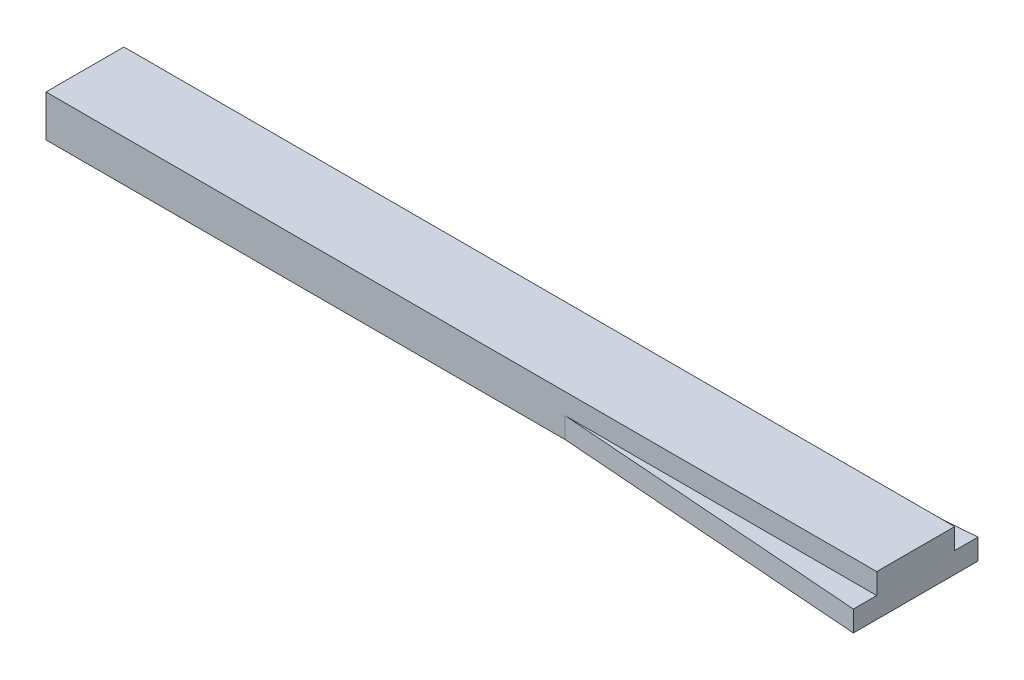
from build123d import *

# Parameters (mm, degrees)
SKETCH1_W           = 160
SKETCH1_H           = 15
BOSS_EXTRUDE1_DEPTH = 4
BOSS_EXTRUDE2_DEPTH = 4


with BuildPart() as part:
    # Sketch1 → Boss-Extrude1 (new body)
    with BuildSketch(Plane(origin=(0, 0, 0), x_dir=(1, 0, 0), z_dir=(0, 1, 0))):
        with Locations((-45.993031359, 57.116724739)):
            Rectangle(SKETCH1_W, SKETCH1_H)
    extrude(amount=BOSS_EXTRUDE1_DEPTH)

    # Sketch2 → Boss-Extrude2 (add)
    with BuildSketch(Plane(origin=(0, 0, 0), x_dir=(1, 0, 0), z_dir=(0, 1, 0))):
        Polygon((-125.993031359, 64.616724739), (-25.993031359, 64.616724739), (34.006968641, 69.116724739), (34.006968641, 45.116724739), (-25.993031359, 49.616724739), (-125.993031359, 49.616724739), align=None)
    extrude(amount=-BOSS_EXTRUDE2_DEPTH)


solid = part.part
